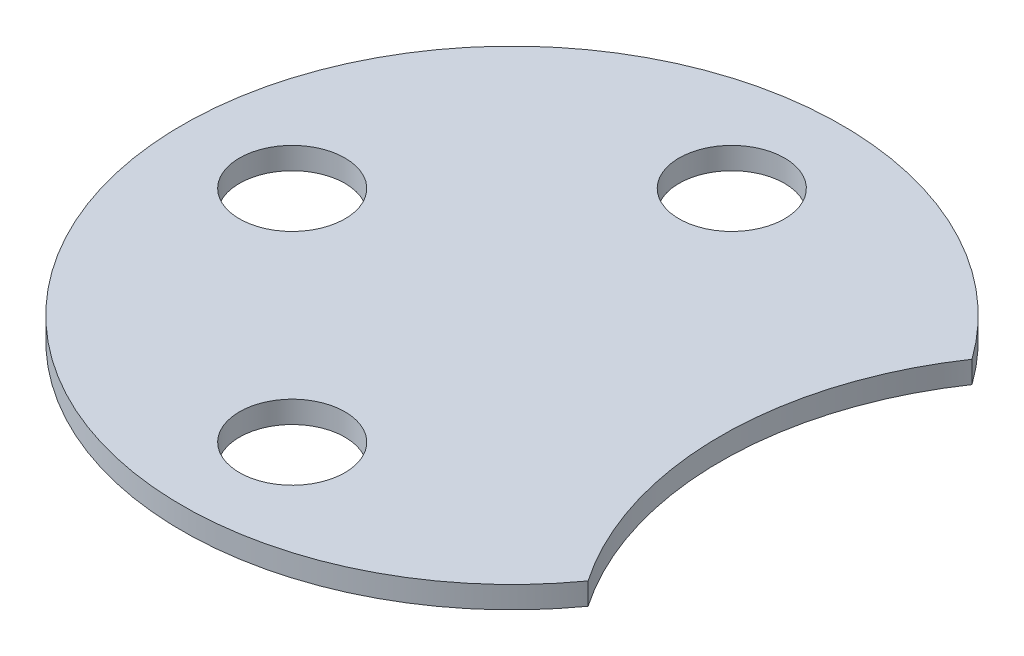
from build123d import *

# Parameters (mm, degrees)
SKETCH_1_R          = 75
EXTRUDE_1_DEPTH     = 5
HOLE_WIZARD_1_D     = 24
SKETCH_4_R          = 77.5
CUT_EXTRUDE_1_DEPTH = 5


with BuildPart() as part:
    # 草图1 → 凸台-拉伸1 (new body)
    with BuildSketch(Plane(origin=(0, 0, 0), x_dir=(1, 0, 0), z_dir=(0, 1, 0))):
        with Locations(Location((0, 0, 0), (0, 0, 270))):
            Circle(SKETCH_1_R)
    extrude(amount=EXTRUDE_1_DEPTH)

    # 孔1 (through all)
    with Locations(Plane.XZ):
        with Locations((0, 50), (0, -50), (-50, 0)):
            Hole(HOLE_WIZARD_1_D / 2)

    # 草图4 → 切除-拉伸1 (cut)
    with BuildSketch(Plane.XZ):
        with Locations((125, 0)):
            Circle(SKETCH_4_R)
    extrude(amount=-CUT_EXTRUDE_1_DEPTH, mode=Mode.SUBTRACT)


solid = part.part
